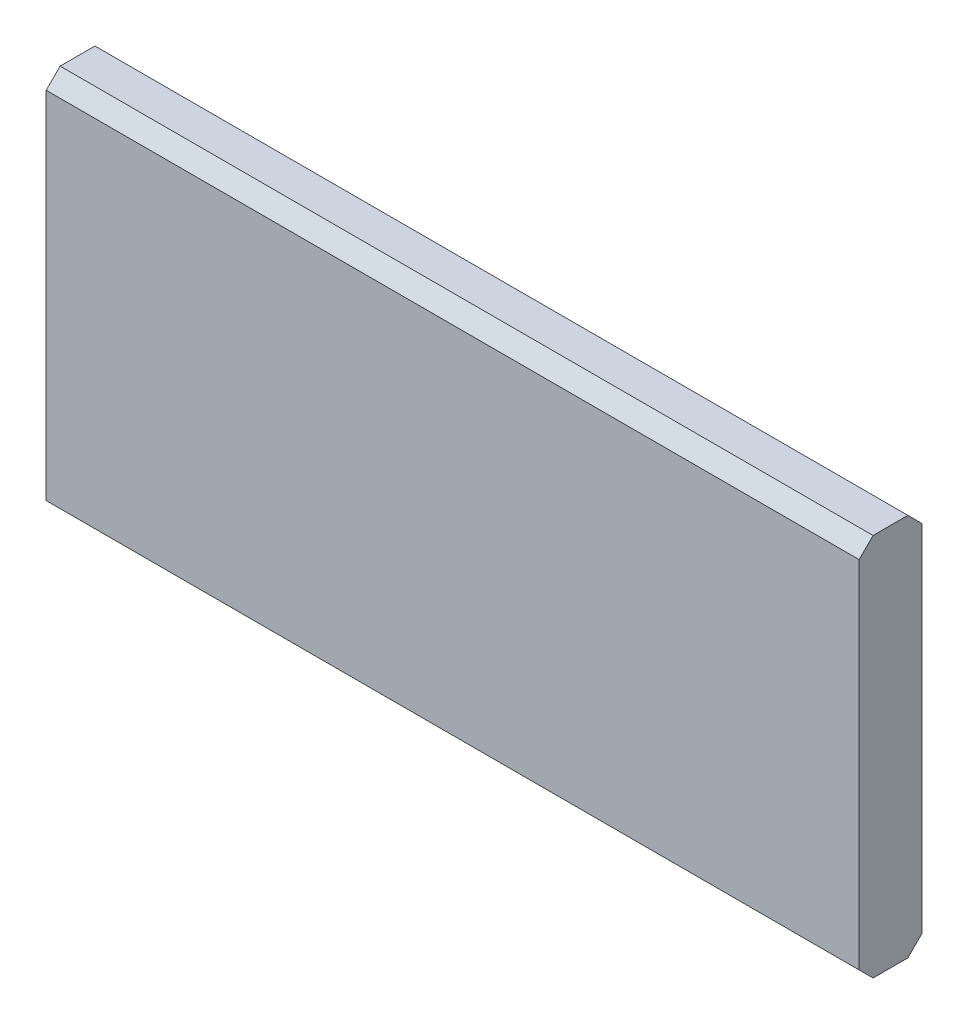
from build123d import *

# Parameters (mm, degrees)
ESQUISSE1_W        = 350
ESQUISSE1_H        = 165
BOSS_EXTRU_1_DEPTH = 27
CHANFREIN1_SIZE    = 6


with BuildPart() as part:
    # Esquisse1 → Boss.-Extru.1 (new body)
    with BuildSketch(Plane.XY):
        with Locations((175, 82.5)):
            Rectangle(ESQUISSE1_W, ESQUISSE1_H)
    extrude(amount=BOSS_EXTRU_1_DEPTH)

    # Chanfrein1
    chanfrein1_edges = [part.edges().sort_by_distance(p)[0] for p in [
        (175, 165, 27),
        (175, 165, 0),
        (175, 0, 0),
        (175, 0, 27),
    ]]
    chamfer(chanfrein1_edges, length=CHANFREIN1_SIZE)


solid = part.part
